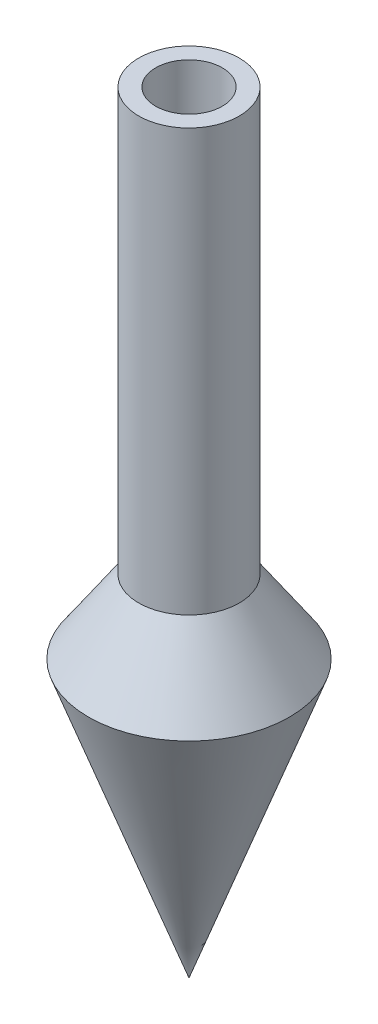
from build123d import *

# Parameters (mm, degrees)
SKETCH4_R          = 86.363199004
CUT_EXTRUDE1_DEPTH = 1293


with BuildPart() as part:
    # Sketch3 → Revolve4 (revolve)
    with BuildSketch(Plane.XY, mode=Mode.PRIVATE) as revolve4_sk:
        Polygon((0, 0), (260.598856402, 715.989473501), (130.299428201, 906.787546279), (130.299428201, 2000), (0, 2000), align=None)
    revolve(revolve4_sk.sketch.rotate(Axis((0, -730.436463526, 0), (0, 1, 0)), 90), axis=Axis((0, -730.436463526, 0), (0, 1, 0)))

    # Sketch4 → Cut-Extrude1 (cut)
    with BuildSketch(Plane(origin=(0, 2000, 0), x_dir=(1, 0, 0), z_dir=(0, 1, 0))):
        with Locations(Location((0, 0, 0), (0, 0, 270))):
            Circle(SKETCH4_R)
    extrude(amount=-CUT_EXTRUDE1_DEPTH, mode=Mode.SUBTRACT)


solid = part.part
